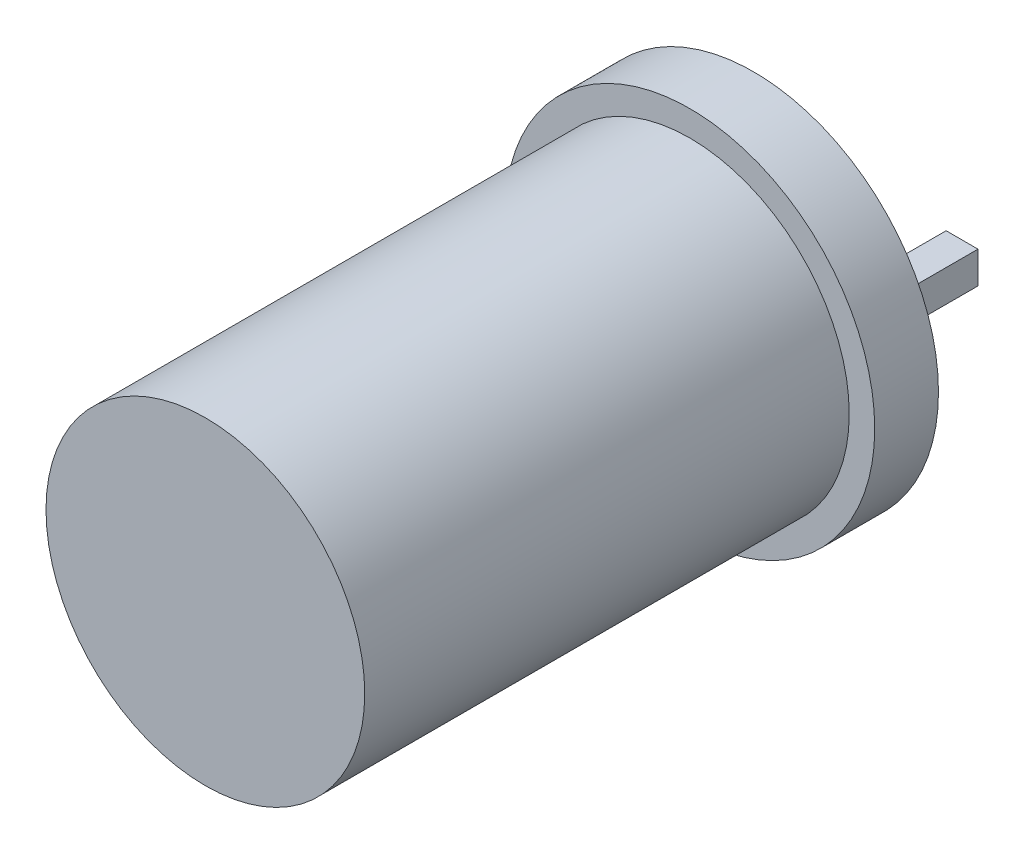
from build123d import *

# Parameters (mm, degrees)
BODY_START   = -8.6
SKETCH1_R    = 2.5
BODY_DEPTH   = 8.6
FLANGE_START = -8.6
SKETCH2_R    = 2.9
FLANGE_DEPTH = 1
LEADS_START  = -8.6
SKETCH3_W    = 0.5
SKETCH3_H    = 0.5
LEADS_DEPTH  = 2


with BuildPart() as part:
    # Sketch1 → Body (new body)
    with BuildSketch(Plane.XY.offset(BODY_START)):
        with Locations(Location((0, 0, 0), (0, 0, 180))):
            Circle(SKETCH1_R)
    extrude(amount=BODY_DEPTH)

    # Sketch2 → Flange (add)
    with BuildSketch(Plane.XY.offset(FLANGE_START)):
        Circle(SKETCH2_R)
    extrude(amount=FLANGE_DEPTH)

    # Sketch3 → Leads (add)
    with BuildSketch(Plane.XY.offset(LEADS_START)):
        with Locations((-1.27, 0)):
            Rectangle(SKETCH3_W, SKETCH3_H)
        with Locations((1.27, 0)):
            Rectangle(SKETCH3_W, SKETCH3_H)
    extrude(amount=-LEADS_DEPTH)


solid = part.part
